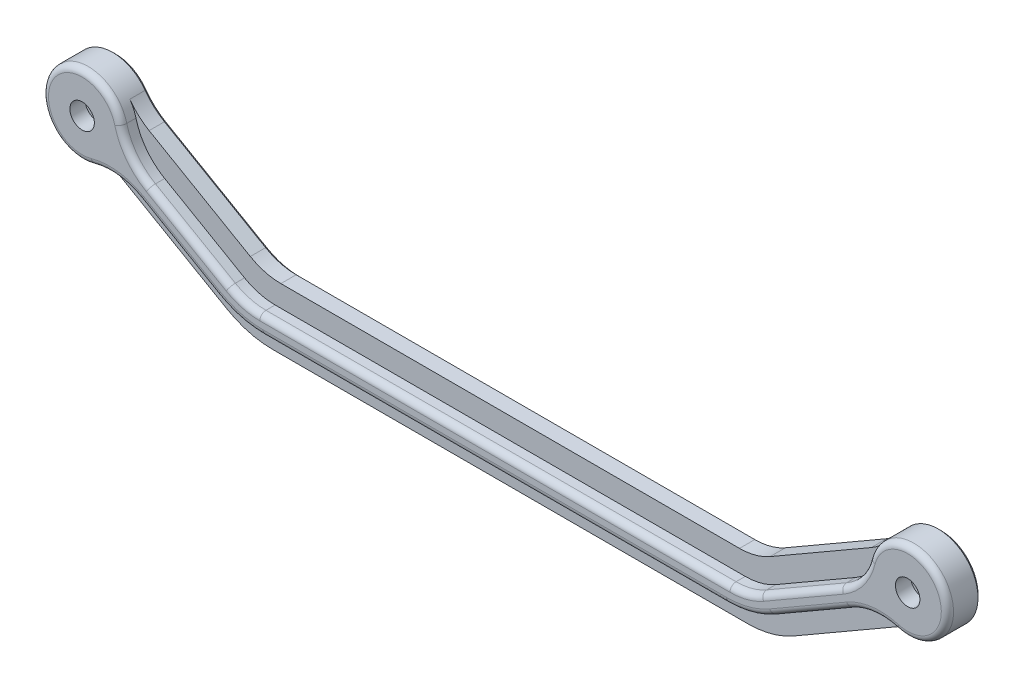
from build123d import *

# Parameters (mm, degrees)
EXTRUDE_1_DEPTH       = 2.500000000014097
EXTRUDE_2_DEPTH       = 2.9999999999999996
HOLE_WIZARD_4_0_4_1_D = 4
FILLET_1_R            = 10
FILLET_2_R            = 15.000000000000004
CHAMFER_1_SIZE        = 0.4999999999999998
FILLET_4_R            = 1
EXTRUDE_START         = -3
SKETCH_5_R            = 1.999999999999988
EXTRUDE_3_DEPTH       = 3


with BuildPart() as part:
    # 草图1 → 凸台-拉伸1 (new body)
    with BuildSketch(Plane.XY.offset(5.5)):
        with BuildLine():
            Line((-62.772774424948345, -4.461315765845048), (-41.9211616751135, -16.50000000000001))
            Line((-41.9211616751135, -16.50000000000001), (41.92116167511347, -16.5))
            Line((41.92116167511347, -16.5), (62.77277442494833, -4.461315765845017))
            ThreePointArc((62.77277442494833, -4.461315765845017), (73.12916512459886, 3.249999999999975), (61.27277442494834, -1.863239554491695))
            Line((61.27277442494834, -1.863239554491695), (41.117314097820056, -13.50000000000001))
            Line((41.117314097820056, -13.50000000000001), (-41.117314097820156, -13.500000000000009))
            Line((-41.117314097820156, -13.500000000000009), (-61.272774424948345, -1.863239554491729))
            ThreePointArc((-61.272774424948345, -1.863239554491729), (-73.12916512459884, 3.2500000000000075), (-62.772774424948345, -4.461315765845048))
        make_face()
    extrude(amount=-EXTRUDE_1_DEPTH)

    # 草图2 → 凸台-拉伸2 (add)
    with BuildSketch(Plane(origin=(0, 0, 2.9999999999859024), x_dir=(-1, 0, 0), z_dir=(0, 0, -1))):
        with BuildLine():
            Line((66.40312635751548, -6.406782984651714), (42.858983848622465, -20))
            Line((42.858983848622465, -20), (-42.85898384862241, -19.999999999999996))
            Line((-42.85898384862241, -19.999999999999996), (-66.40312635751543, -6.406782984651706))
            ThreePointArc((-66.40312635751543, -6.406782984651706), (-73.12916512459887, 3.24999999999996), (-61.40312635751548, 2.253471053192728))
            Line((-61.40312635751548, 2.253471053192728), (-40.17949192431118, -9.999999999999998))
            Line((-40.17949192431118, -9.999999999999998), (40.17949192431122, -10.000000000000009))
            Line((40.17949192431122, -10.000000000000009), (61.40312635751546, 2.2534710531926625))
            ThreePointArc((61.40312635751546, 2.2534710531926625), (73.12916512459884, 3.250000000000009), (66.40312635751548, -6.406782984651714))
        make_face()
    extrude(amount=EXTRUDE_2_DEPTH)

    # Ø4.0 (4) 直径孔1 (through all)
    with Locations(Plane(origin=(0, 0, 0), x_dir=(-1, 0, 0), z_dir=(0, 0, -1))):
        with Locations((67.5, 0), (-67.5, 0)):
            Hole(HOLE_WIZARD_4_0_4_1_D / 2)

    # 圆角1
    fillet_1_edges = [part.edges().sort_by_distance(p)[0] for p in [
        (-61.27277442494835, -1.8632395544917282, 4.249999999992951),
        (-41.117314097820156, -13.500000000000009, 4.249999999992951),
        (41.117314097820056, -13.50000000000001, 4.249999999992951),
        (61.27277442494834, -1.863239554491694, 4.249999999992951),
        (62.77277442494834, -4.461315765845014, 4.249999999992951),
        (-62.772774424948345, -4.461315765845047, 4.249999999992951),
        (-66.40312635751548, -6.406782984651716, 1.4999999999859026),
        (-61.40312635751547, 2.2534710531926603, 1.4999999999859026),
        (-40.17949192431122, -10.000000000000009, 1.4999999999859026),
        (40.17949192431118, -9.999999999999998, 1.4999999999859026),
        (61.403126357515475, 2.2534710531927282, 1.4999999999859026),
        (66.40312635751543, -6.406782984651702, 1.4999999999859026),
    ]]
    fillet(fillet_1_edges, radius=FILLET_1_R)

    # 圆角2
    fillet_2_edges = [part.edges().sort_by_distance(p)[0] for p in [
        (41.92116167511347, -16.5, 4.249999999992951),
        (-41.9211616751135, -16.50000000000001, 4.249999999992951),
        (42.85898384862241, -19.999999999999996, 1.4999999999859026),
        (-42.858983848622465, -20, 1.4999999999859026),
    ]]
    fillet(fillet_2_edges, radius=FILLET_2_R)

    # 倒角1
    chamfer_1_edges = [part.edges().sort_by_distance(p)[0] for p in [
        (-55.193402756130126, -12.878719923452845, -1.409717e-11),
        (-1.421e-14, -19.999999999999996, -1.409717e-11),
        (42.722031638693394, -19.488887394336025, -1.409717e-11),
        (-42.72203163869342, -19.48888739433603, -1.409717e-11),
        (50.77352977505234, -3.883529395069502, -1.409717e-11),
        (-2.132e-14, -10.000000000000004, -1.409717e-11),
        (-50.77352977505235, -3.8835293950695364, -1.409717e-11),
        (-73.12916512459887, 3.2499999999999756, -1.409717e-11),
        (55.193402756130126, -12.878719923452813, -1.409717e-11),
        (73.12916512459886, 3.2499999999999876, -1.409717e-11),
        (40.088190451025156, -9.659258262890683, -1.409717e-11),
        (-60.778474019386664, 2.158311745061262, -1.409717e-11),
        (66.00838981020269, -6.900168123938897, -1.409717e-11),
        (-40.08819045102521, -9.65925826289069, -1.409717e-11),
        (60.778474019386664, 2.1583117450613107, -1.409717e-11),
        (-66.00838981020267, -6.900168123938933, -1.409717e-11),
    ]]
    chamfer(chamfer_1_edges, length=CHAMFER_1_SIZE)

    # 圆角4
    fillet_4_edges = [part.edges().sort_by_distance(p)[0] for p in [
        (-1.421e-14, -16.500000000000004, 5.5),
        (51.70248651134352, -10.85274947277141, 5.5),
        (-41.784209465184475, -15.988887394336034, 5.5),
        (41.78420946518445, -15.988887394336027, 5.5),
        (-73.12916512459887, 3.2499999999999796, 5.5),
        (73.12916512459886, 3.250000000000003, 5.5),
        (49.970435703774626, -8.388647857633657, 5.5),
        (-4.974e-14, -13.50000000000001, 5.5),
        (-49.970435703774676, -8.388647857633675, 5.5),
        (-51.70248651134354, -10.852749472771439, 5.5),
        (59.47971041107501, -1.9877806313493807, 5.5),
        (-41.02601262453415, -13.159258262890692, 5.5),
        (-59.479710411075004, -1.9877806313494268, 5.5),
        (-61.76838668163823, -5.951884214042208, 5.5),
        (61.76838668163825, -5.951884214042176, 5.5),
        (41.02601262453404, -13.159258262890695, 5.5),
    ]]
    fillet(fillet_4_edges, radius=FILLET_4_R)

    # 草图5 → 凸台-拉伸3 (add)
    with BuildSketch(Plane(origin=(0, 0, 0), x_dir=(-1, 0, 0), z_dir=(0, 0, -1)).offset(EXTRUDE_START)):
        with Locations((67.5, 0)):
            Circle(SKETCH_5_R)
        with Locations((-67.5, 0)):
            Circle(SKETCH_5_R)
    extrude(amount=EXTRUDE_3_DEPTH)


solid = part.part
